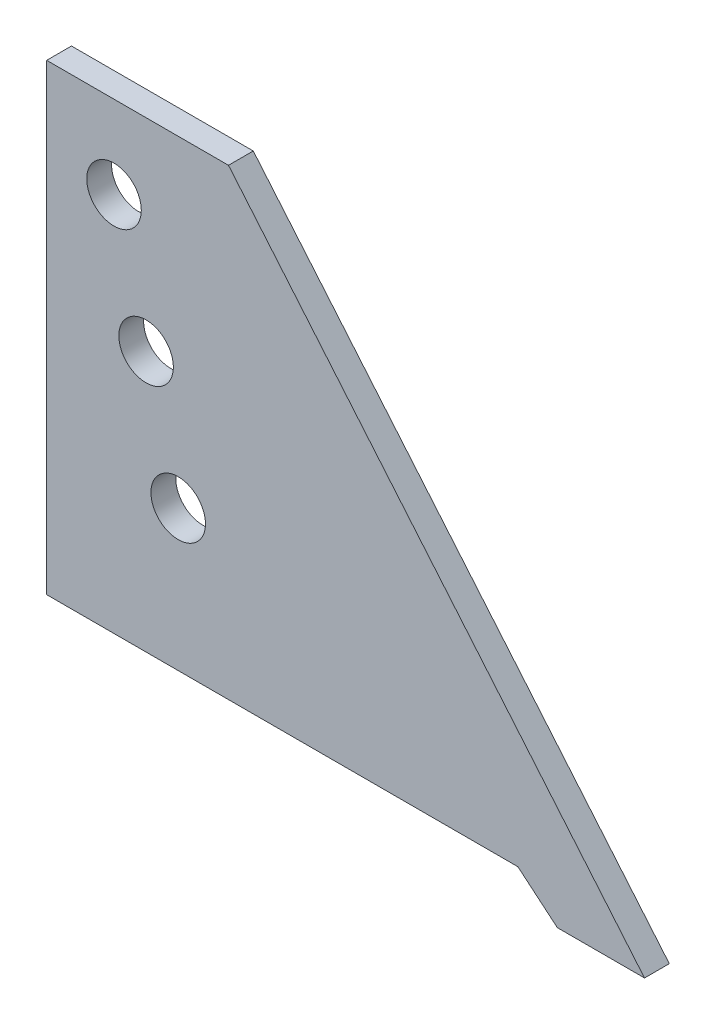
from build123d import *

# Parameters (mm, degrees)
RESSALTO_EXTRUS_O1_DEPTH = 3
FURO_COM_FOLGA_DE_M61_D  = 6.6
CORTE_EXTRUS_O1_DEPTH    = 95.036910381


with BuildPart() as part:
    # Esboço1 → Ressalto-extrusão1 (new body)
    with BuildSketch(Plane.XY):
        Polygon((0, 0), (0, 60), (22, 60), (72.345977871, 0), align=None)
    extrude(amount=RESSALTO_EXTRUS_O1_DEPTH)

    # Furo com folga de M61 (through all)
    with Locations(Plane.XY.offset(3)):
        with Locations((15.913142528, 21.022225211), (12.030856852, 35.511112606), (8.148571175, 50)):
            Hole(FURO_COM_FOLGA_DE_M61_D / 2)

    # Esboço4 → Corte-extrusão1 (cut, through all)
    with BuildSketch(Plane.XY.offset(3)):
        Polygon((0, 4), (57.02406918, 4), (61.791083551, 0), (0, 0), align=None)
    extrude(amount=-CORTE_EXTRUS_O1_DEPTH, mode=Mode.SUBTRACT)


solid = part.part
